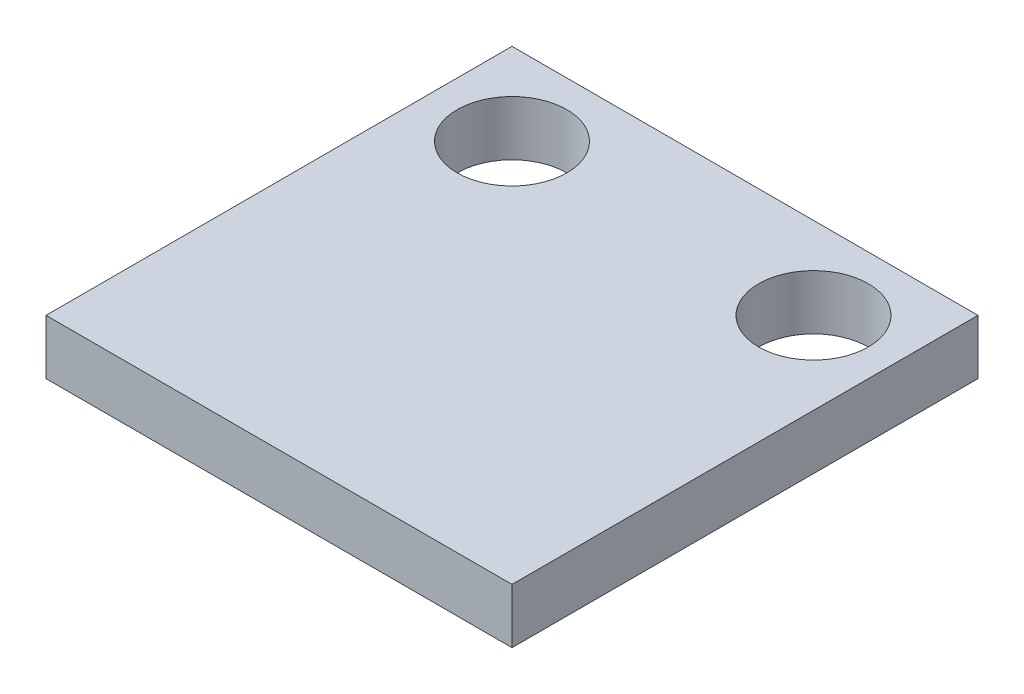
from build123d import *

# Parameters (mm, degrees)
SKETCH1_W           = 17
SKETCH1_H           = 17
SKETCH1_R           = 2
BOSS_EXTRUDE1_DEPTH = 2


with BuildPart() as part:
    # Sketch1 → Boss-Extrude1 (new body)
    with BuildSketch(Plane(origin=(0, 0, 0), x_dir=(1, 0, 0), z_dir=(0, 1, 0))):
        with Locations((8.5, 8.5)):
            Rectangle(SKETCH1_W, SKETCH1_H)
        with Locations(Location((3, 14, 0), (0, 0, 270))):
            Circle(SKETCH1_R, mode=Mode.SUBTRACT)
        with Locations(Location((14, 14, 0), (0, 0, 270))):
            Circle(SKETCH1_R, mode=Mode.SUBTRACT)
    extrude(amount=BOSS_EXTRUDE1_DEPTH)


solid = part.part
